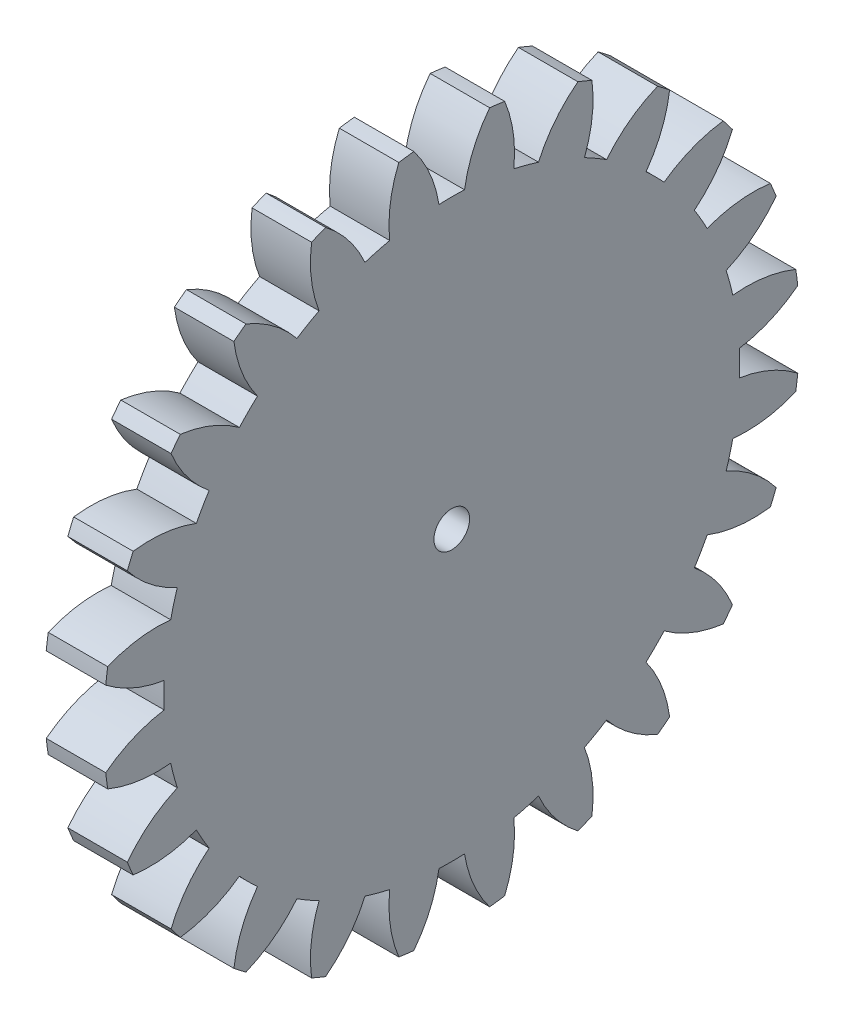
from build123d import *

# Parameters (mm, degrees)
BASPROSKE_W     = 5
BASPROSKE_H     = 29.25
TOOTHCUT_DEPTH  = 42.666833333
TEETHCUTS_COUNT = 24
TEETHCUTS_ANGLE = 345
BORSKE_R        = 1.5
BORE_DEPTH      = 50.0000508


with BuildPart() as part:
    # BasProSke → Base-Revolve (revolve)
    with BuildSketch(Plane(origin=(0, 0, 0), x_dir=(1, 0, 0), z_dir=(0, 1, 0)), mode=Mode.PRIVATE) as base_revolve_sk:
        with Locations((2.5, 14.625)):
            Rectangle(BASPROSKE_W, BASPROSKE_H)
    revolve(base_revolve_sk.sketch.rotate(Axis((-10, 0, 0), (1, 0, 0)), 180), axis=Axis((-10, 0, 0), (1, 0, 0)))

    # TooCutSke → ToothCut (cut, through all)
    with BuildSketch(Plane(origin=(0, 0, 0), x_dir=(0, 0, -1), z_dir=(1, 0, 0))):
        with BuildLine():
            ThreePointArc((1.074618497, 24.162615283), (0, 24.1865), (-1.074618497, 24.162615283))
            ThreePointArc((-1.074618497, 24.162615283), (-1.826761836, 26.765693566), (-3.203149857, 29.099637045))
            ThreePointArc((-3.203149857, 29.099637045), (0, 29.2754), (3.203149857, 29.099637045))
            ThreePointArc((3.203149857, 29.099637045), (1.826761836, 26.765693566), (1.074618497, 24.162615283))
        make_face()
    toothcut = extrude(amount=TOOTHCUT_DEPTH, mode=Mode.SUBTRACT)

    # TeethCuts: ToothCut ×24 about axis
    teethcuts_axis = Axis((-10, 0, 0), (1, 0, 0))
    for i in range(1, TEETHCUTS_COUNT):
        add(toothcut.rotate(teethcuts_axis, i * TEETHCUTS_ANGLE / (TEETHCUTS_COUNT - 1)), mode=Mode.SUBTRACT)

    # BorSke → Bore (cut, symmetric)
    with BuildSketch(Plane(origin=(0, 0, 0), x_dir=(0, 0, -1), z_dir=(1, 0, 0))):
        with Locations(Location((0, 0, 0), (0, 0, 180))):
            Circle(BORSKE_R)
    extrude(amount=BORE_DEPTH, both=True, mode=Mode.SUBTRACT)


solid = part.part
